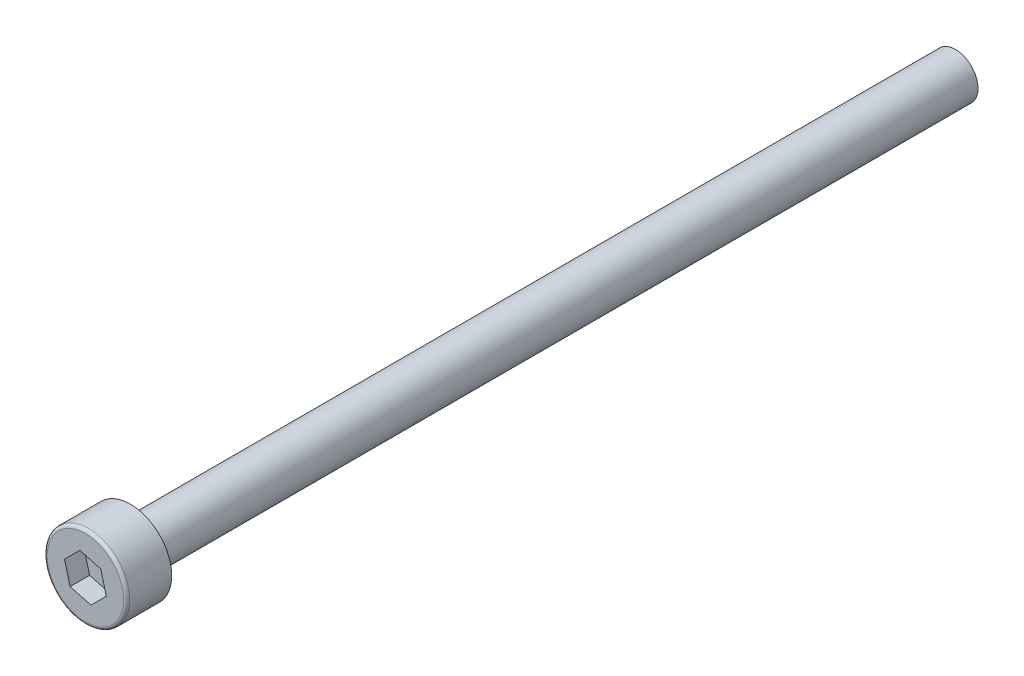
from build123d import *

# Parameters (mm, degrees)
SKETCH_1_R          = 2.75
EXTRUDE_1_DEPTH     = 3
CUT_EXTRUDE_1_DEPTH = 1.3
SKETCH_3_R          = 1.5
EXTRUDE_2_DEPTH     = 55
FILLET_1_R          = 0.2


with BuildPart() as part:
    # 草图1 → 凸台-拉伸1 (new body)
    with BuildSketch(Plane.XY):
        Circle(SKETCH_1_R)
    extrude(amount=EXTRUDE_1_DEPTH)

    # 草图2 → 切除-拉伸1 (cut)
    with BuildSketch(Plane.XY.offset(3)):
        Polygon((-1.020620726, -1.020620726), (0.373573113, -1.39419384), (1.39419384, -0.373573113), (1.020620726, 1.020620726), (-0.373573113, 1.39419384), (-1.39419384, 0.373573113), align=None)
    extrude(amount=-CUT_EXTRUDE_1_DEPTH, mode=Mode.SUBTRACT)

    # 草图3 → 凸台-拉伸2 (add)
    with BuildSketch(Plane(origin=(0, 0, 0), x_dir=(-1, 0, 0), z_dir=(0, 0, -1))):
        with Locations(Location((0, 0, 0), (0, 0, 180))):
            Circle(SKETCH_3_R)
    extrude(amount=EXTRUDE_2_DEPTH)

    # 圆角1
    fillet_1_edges = [part.edges().sort_by_distance(p)[0] for p in [
        (-2.75, 0, 3),
    ]]
    fillet(fillet_1_edges, radius=FILLET_1_R)


solid = part.part
